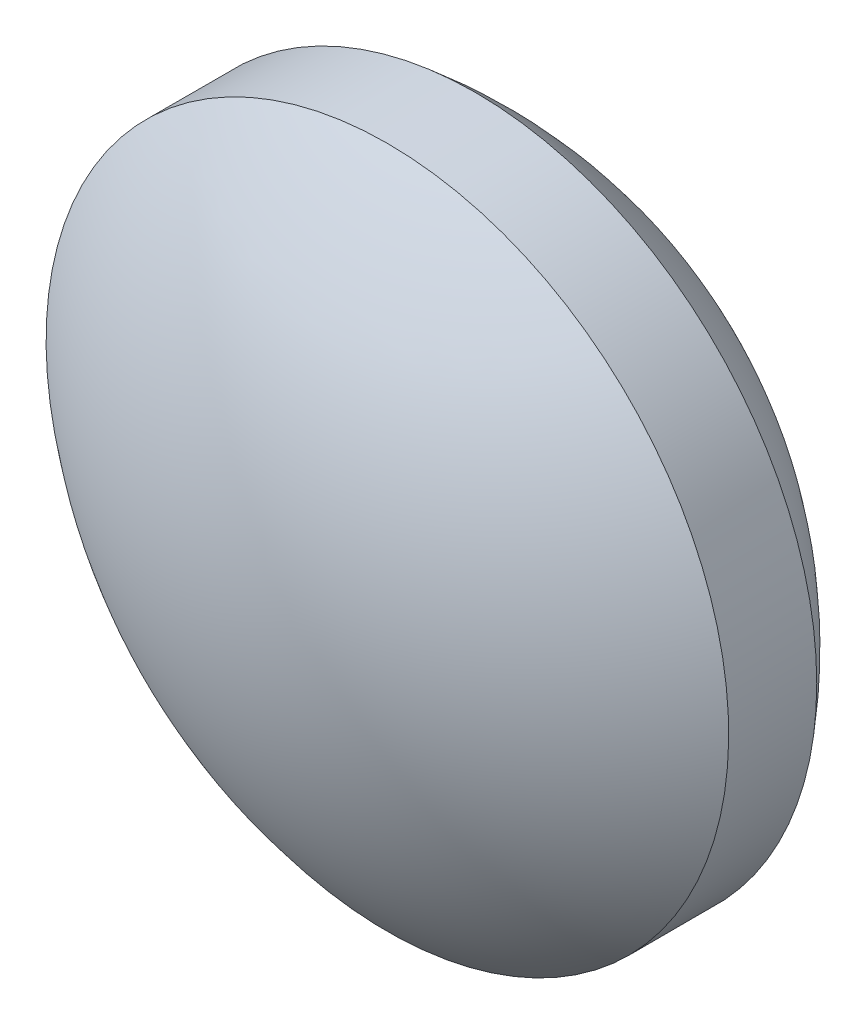
from build123d import *


with BuildPart() as part:
    # Sketch3 → Revolve1 (revolve)
    with BuildSketch(Plane(origin=(0, 0, 0), x_dir=(0, 0, -1), z_dir=(1, 0, 0))):
        with BuildLine():
            Line((0, 3.875), (0, 0))
            Line((0, 0), (2.340193835, 0))
            ThreePointArc((2.340193835, 0), (1.856776106, 2.144874026), (0.5, 3.875))
            Line((0.5, 3.875), (0, 3.875))
        make_face()
        with BuildLine():
            Line((-1.91912945, 0), (0, 0))
            Line((0, 0), (0, 3.875))
            Line((0, 3.875), (-0.5, 3.875))
            ThreePointArc((-0.5, 3.875), (-1.553187636, 2.063343972), (-1.91912945, 0))
        make_face()
    revolve(axis=Axis((0, 0, 0), (0, 0, 1)))


solid = part.part
